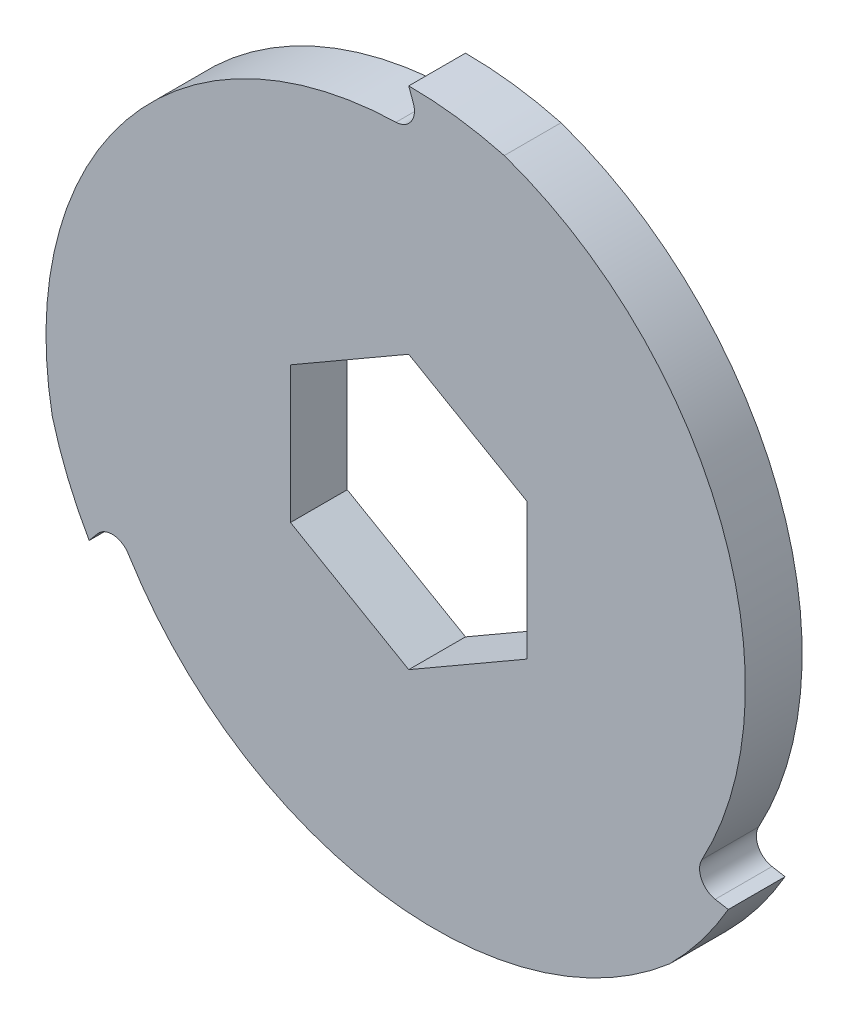
from build123d import *

# Parameters (mm, degrees)
BOSS_EXTRUDE1_DEPTH = 3
FILLET1_R           = 2


with BuildPart() as part:
    # Sketch1 → Boss-Extrude1 (new, symmetric)
    with BuildSketch(Plane.XY):
        with BuildLine():
            ThreePointArc((10.093942759, 37.671107225), (5.090521497, 38.666349594), (0, 39))
            Line((0, 39), (1.467076979, 34.969239127))
            ThreePointArc((1.467076979, 34.969239127), (-29.031358559, 21.929979589), (-37.671107225, -10.093942759))
            ThreePointArc((-37.671107225, -10.093942759), (-36.031301768, -14.924653862), (-33.774990748, -19.5))
            Line((-33.774990748, -19.5), (-31.017787925, -16.21409363))
            ThreePointArc((-31.017787925, -16.21409363), (-4.476240149, -36.106883814), (27.577164466, -27.577164466))
            ThreePointArc((27.577164466, -27.577164466), (30.940780271, -23.741695731), (33.774990748, -19.5))
            Line((33.774990748, -19.5), (29.550710946, -18.755145497))
            ThreePointArc((29.550710946, -18.755145497), (33.507598709, 14.176904224), (10.093942759, 37.671107225))
        make_face()
        Polygon((-12.5, 7.216878365), (0, 14.43375673), (12.5, 7.216878365), (12.5, -7.216878365), (0, -14.43375673), (-12.5, -7.216878365), align=None, mode=Mode.SUBTRACT)
    extrude(amount=BOSS_EXTRUDE1_DEPTH, both=True)

    # Fillet1
    fillet1_edges = [part.edges().sort_by_distance(p)[0] for p in [
        (1.467076979, 34.969239127, 0),
        (29.550710946, -18.755145497, 0),
        (-31.017787925, -16.21409363, 0),
    ]]
    fillet(fillet1_edges, radius=FILLET1_R)


solid = part.part
